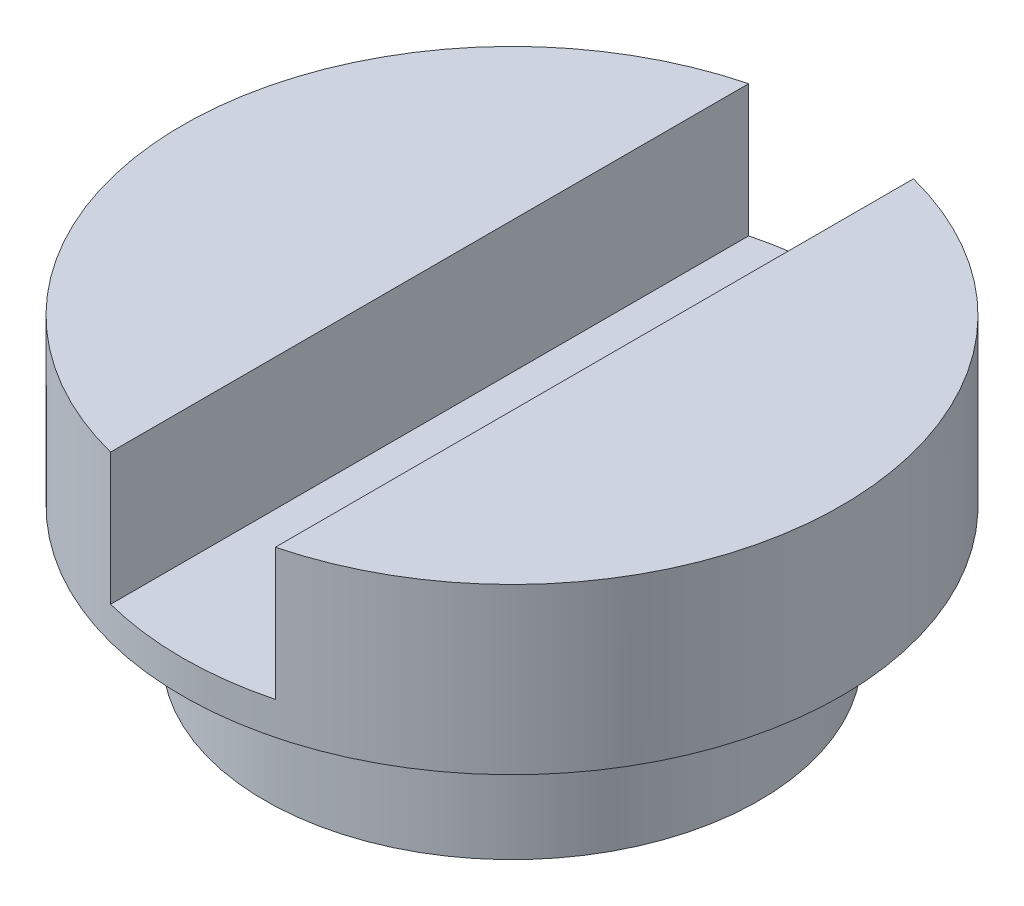
from build123d import *
from build123d.topology import SkipClean

# Parameters (mm, degrees)
BOSS_EXTRUDE1_DEPTH = 1.27
BOSS_EXTRUDE2_START = 5.08
BOSS_EXTRUDE2_DEPTH = 5.08
SKETCH3_R           = 9.525
BOSS_EXTRUDE3_DEPTH = 5.08
CUT_EXTRUDE2_START  = -4.85
SKETCH7_R           = 2.85
CUT_EXTRUDE2_DEPTH  = 4.85


with BuildPart() as part:
    # Sketch1 → Boss-Extrude1 (new body)
    with BuildSketch(Plane.XZ.offset(-243.34664948)):
        with BuildLine():
            ThreePointArc((170.976440709, 548.746338149), (161.451440709, 536.449616024), (170.976440709, 524.1528939))
            ThreePointArc((170.976440709, 524.1528939), (174.151440709, 523.749616024), (177.326440709, 524.1528939))
            ThreePointArc((177.326440709, 524.1528939), (186.851440709, 536.449616024), (177.326440709, 548.746338149))
            ThreePointArc((177.326440709, 548.746338149), (174.151440709, 549.149616024), (170.976440709, 548.746338149))
        make_face()
    extrude(amount=BOSS_EXTRUDE1_DEPTH)

    # Sketch2 → Boss-Extrude2 (add)
    with SkipClean():  # the faces are left unmerged after this step: merging them gives an invalid solid
        with BuildSketch(Plane(origin=(0, 243.34664948, 0), x_dir=(1, 0, 0), z_dir=(0, 1, 0)).offset(BOSS_EXTRUDE2_START)):
            with BuildLine():
                Line((177.326440709, -524.1528939), (177.326440709, -548.746338149))
                ThreePointArc((177.326440709, -548.746338149), (186.851440709, -536.449616024), (177.326440709, -524.1528939))
            make_face()
            with BuildLine():
                Line((170.976440709, -548.746338149), (170.976440709, -524.1528939))
                ThreePointArc((170.976440709, -524.1528939), (161.451440709, -536.449616024), (170.976440709, -548.746338149))
            make_face()
        extrude(amount=-BOSS_EXTRUDE2_DEPTH)

    # Sketch3 → Boss-Extrude3 (add)
    with SkipClean():  # the faces are left unmerged after this step: merging them gives an invalid solid
        with BuildSketch(Plane.XZ.offset(-242.07664948)):
            with Locations(Location((174.151440709, 536.449616024, 0), (0, 0, 270))):
                Circle(SKETCH3_R)
        extrude(amount=BOSS_EXTRUDE3_DEPTH)

    # Sketch7 → Cut-Extrude2 (cut)
    with SkipClean():  # the faces are left unmerged after this step: merging them gives an invalid solid
        with BuildSketch(Plane.XZ.offset(-236.99664948).offset(CUT_EXTRUDE2_START)):
            with Locations(Location((174.151440709, 536.449616024, 0), (0, 0, 270))):
                Circle(SKETCH7_R)
        extrude(amount=CUT_EXTRUDE2_DEPTH, mode=Mode.SUBTRACT)


solid = part.part
